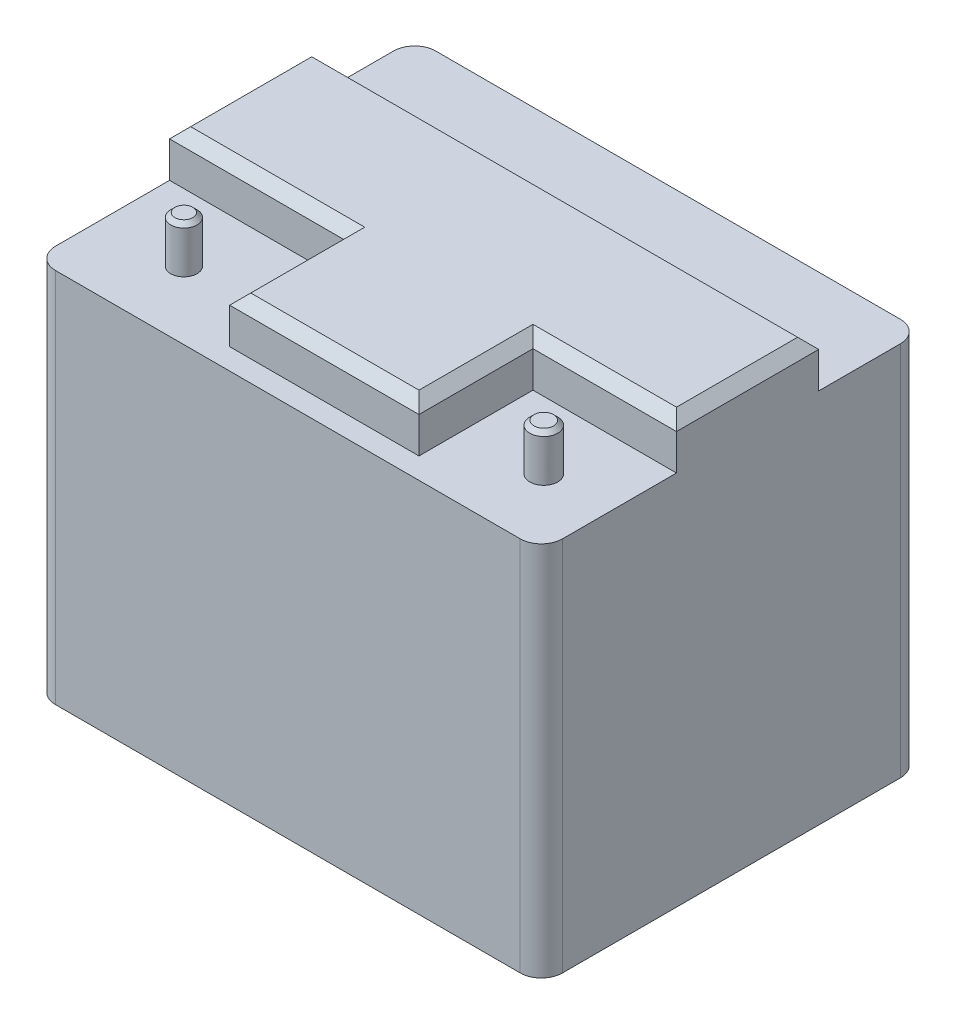
from build123d import *

# Parameters (mm, degrees)
SALIENTE_EXTRUIR2_DEPTH = 200
CORTAR_EXTRUIR1_START   = -22
CROQUIS2_R              = 6.238263744
CROQUIS2_R_2            = 6.628155228
CORTAR_EXTRUIR1_DEPTH   = 22
CHAFL_N1_SIZE           = 2
CHAFL_N2_SIZE           = 5


with BuildPart() as part:
    # Croquis1 → Saliente-Extruir2 (new body)
    with BuildSketch(Plane(origin=(0, 0, 0), x_dir=(1, 0, 0), z_dir=(0, 1, 0))):
        with BuildLine():
            Line((-110, 90), (110, 90))
            ThreePointArc((110, 90), (117.071067812, 87.071067812), (120, 80))
            Line((120, 80), (120, -80))
            ThreePointArc((120, -80), (117.071067812, -87.071067812), (110, -90))
            Line((110, -90), (-110, -90))
            ThreePointArc((-110, -90), (-117.071067812, -87.071067812), (-120, -80))
            Line((-120, -80), (-120, 80))
            ThreePointArc((-120, 80), (-117.071067812, 87.071067812), (-110, 90))
        make_face()
    extrude(amount=SALIENTE_EXTRUIR2_DEPTH)

    # Croquis2 → Cortar-Extruir1 (cut)
    # profile 1 of 2: a face of its own
    with BuildSketch(Plane(origin=(0, 200, 0), x_dir=(1, 0, 0), z_dir=(0, 1, 0)).offset(CORTAR_EXTRUIR1_START)):
        with BuildLine():
            Line((-120, 80), (-120, 41.298746549))
            Line((-120, 41.298746549), (120, 41.298746549))
            Line((120, 41.298746549), (120, 80))
            ThreePointArc((120, 80), (117.071067812, 87.071067812), (110, 90))
            Line((110, 90), (-110, 90))
            ThreePointArc((-110, 90), (-117.071067812, 87.071067812), (-120, 80))
        make_face()
    # profile 2 of 2: a face of its own
    with BuildSketch(Plane(origin=(0, 200, 0), x_dir=(1, 0, 0), z_dir=(0, 1, 0)).offset(CORTAR_EXTRUIR1_START)):
        with BuildLine():
            Line((-37.579902073, -26.031911332), (-120, -26.031911332))
            Line((-120, -26.031911332), (-120, -80))
            ThreePointArc((-120, -80), (-117.071067812, -87.071067812), (-110, -90))
            Line((-110, -90), (110, -90))
            ThreePointArc((110, -90), (117.071067812, -87.071067812), (120, -80))
            Line((120, -80), (120, -26.031911332))
            Line((120, -26.031911332), (52.063822663, -26.031911332))
            Line((52.063822663, -26.031911332), (52.063822663, -80))
            Line((52.063822663, -80), (-37.579902073, -80))
            Line((-37.579902073, -80), (-37.579902073, -26.031911332))
        make_face()
        with Locations(Location((-81.424491258, -57.813449816, 0), (0, 0, 270))):
            Circle(CROQUIS2_R, mode=Mode.SUBTRACT)
        with Locations(Location((88.958087252, -57.813449816, 0), (0, 0, 270))):
            Circle(CROQUIS2_R_2, mode=Mode.SUBTRACT)
    extrude(amount=CORTAR_EXTRUIR1_DEPTH, mode=Mode.SUBTRACT)

    # Chaflán1
    chafl_n1_edges = [part.edges().sort_by_distance(p)[0] for p in [
        (-81.424491258, 200, 51.575186072),
        (88.958087252, 200, 51.185294588),
    ]]
    chamfer(chafl_n1_edges, length=CHAFL_N1_SIZE)

    # Chaflán2
    chafl_n2_edges = [part.edges().sort_by_distance(p)[0] for p in [
        (-120, 200, -7.633417609),
        (0, 200, -41.298746549),
        (120, 200, -7.633417609),
        (52.063822663, 200, 53.015955666),
        (-37.579902073, 200, 53.015955666),
        (7.241960295, 200, 80),
        (-78.789951036, 200, 26.031911332),
        (86.031911332, 200, 26.031911332),
    ]]
    chamfer(chafl_n2_edges, length=CHAFL_N2_SIZE)


solid = part.part
